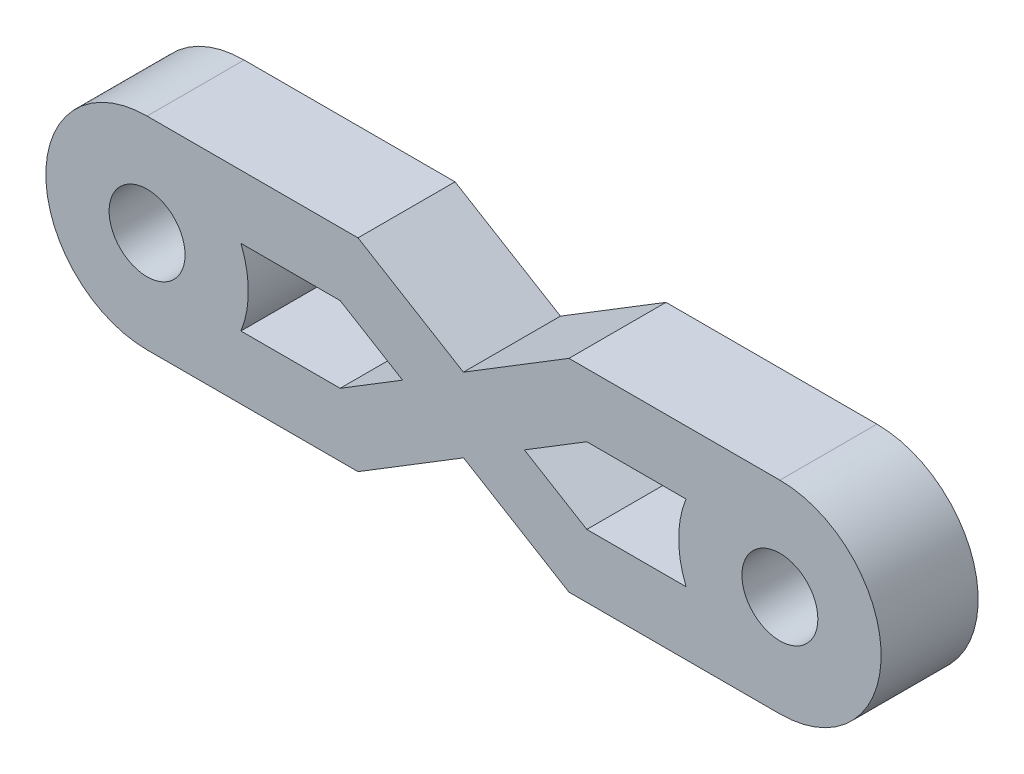
from build123d import *

# Parameters (mm, degrees)
SKETCH2_R           = 4.8
SKETCH2_R_2         = 1.8
BOSS_EXTRUDE1_DEPTH = 4.6


with BuildPart() as part:
    # Sketch2 → Boss-Extrude1 (new body)
    # profile 1 of 3: a face of its own
    with BuildSketch(Plane.XY):
        with Locations((-117.224103079, -0.052328238)):
            Circle(SKETCH2_R)
        with Locations(Location((-117.224103079, -0.052328238, 0), (0, 0, 141.059939776))):
            Circle(SKETCH2_R_2, mode=Mode.SUBTRACT)
    # profile 2 of 3: a face of its own
    with BuildSketch(Plane.XY):
        with BuildLine():
            ThreePointArc((-112.774383987, -1.852328238), (-114.540821506, -4.032277987), (-117.224103079, -4.852328238))
            Line((-117.224103079, -4.852328238), (-107.224087867, -4.852328238))
            Line((-107.224087867, -4.852328238), (-102.220792221, -1.783747748))
            Line((-102.220792221, -1.783747748), (-97.224209567, -4.8))
            Line((-97.224209567, -4.8), (-87.224194355, -4.8))
            ThreePointArc((-87.224194355, -4.8), (-89.907475928, -3.979949748), (-91.673913447, -1.8))
            Line((-91.673913447, -1.8), (-96.377520534, -1.8))
            Line((-96.377520534, -1.8), (-99.335675261, -0.014271338))
            Line((-99.335675261, -0.014271338), (-96.377520534, 1.8))
            Line((-96.377520534, 1.8), (-91.673913447, 1.8))
            ThreePointArc((-91.673913447, 1.8), (-89.907475928, 3.979949748), (-87.224194355, 4.8))
            Line((-87.224194355, 4.8), (-97.224209567, 4.8))
            Line((-97.224209567, 4.8), (-102.227505213, 1.731419509))
            Line((-102.227505213, 1.731419509), (-107.224087867, 4.747671762))
            Line((-107.224087867, 4.747671762), (-117.224103079, 4.747671762))
            ThreePointArc((-117.224103079, 4.747671762), (-114.540821506, 3.92762151), (-112.774383987, 1.747671762))
            Line((-112.774383987, 1.747671762), (-108.0707769, 1.747671762))
            Line((-108.0707769, 1.747671762), (-105.112622173, -0.0380569))
            Line((-105.112622173, -0.0380569), (-108.0707769, -1.852328238))
            Line((-108.0707769, -1.852328238), (-112.774383987, -1.852328238))
        make_face()
    # profile 3 of 3: a face of its own
    with BuildSketch(Plane.XY):
        with Locations((-87.224194355, 0)):
            Circle(SKETCH2_R)
        with Locations(Location((-87.224194355, 0, 0), (0, 0, 141.059939776))):
            Circle(SKETCH2_R_2, mode=Mode.SUBTRACT)
    extrude(amount=BOSS_EXTRUDE1_DEPTH)


solid = part.part
